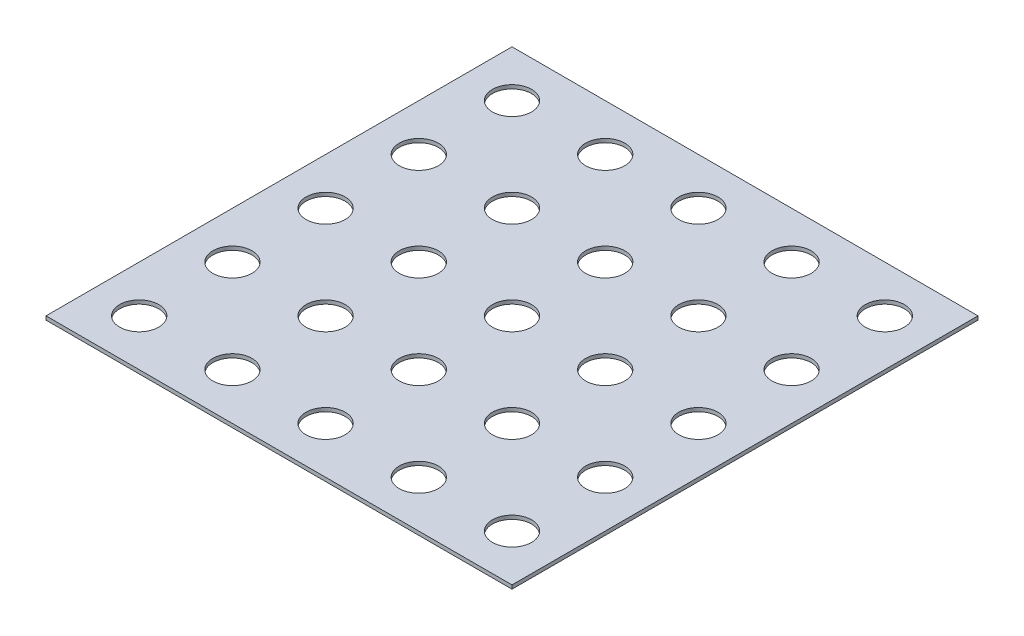
from build123d import *

# Parameters (mm, degrees)
SKETCH1_W           = 250
SKETCH1_H           = 250
BOSS_EXTRUDE1_DEPTH = 2
SKETCH2_R           = 10.5
CUT_EXTRUDE1_DEPTH  = 177.788008643


with BuildPart() as part:
    # Sketch1 → Boss-Extrude1 (new body)
    with BuildSketch(Plane(origin=(0, 0, 0), x_dir=(1, 0, 0), z_dir=(0, 1, 0))):
        Rectangle(SKETCH1_W, SKETCH1_H)
    extrude(amount=BOSS_EXTRUDE1_DEPTH)

    # Sketch2 → Cut-Extrude1 (cut, through all)
    with BuildSketch(Plane(origin=(0, 2, 0), x_dir=(1, 0, 0), z_dir=(0, 1, 0))):
        with Locations(Location((-100, 100, 0), (0, 0, 270))):
            Circle(SKETCH2_R)
        with Locations(Location((-50, 100, 0), (0, 0, 270))):
            Circle(SKETCH2_R)
        with Locations(Location((0, 100, 0), (0, 0, 270))):
            Circle(SKETCH2_R)
        with Locations(Location((50, 100, 0), (0, 0, 270))):
            Circle(SKETCH2_R)
        with Locations(Location((100, 100, 0), (0, 0, 270))):
            Circle(SKETCH2_R)
        with Locations(Location((-50, 50, 0), (0, 0, 270))):
            Circle(SKETCH2_R)
        with Locations(Location((0, 50, 0), (0, 0, 270))):
            Circle(SKETCH2_R)
        with Locations(Location((50, 50, 0), (0, 0, 270))):
            Circle(SKETCH2_R)
        with Locations(Location((100, 50, 0), (0, 0, 270))):
            Circle(SKETCH2_R)
        with Locations(Location((-50, 0, 0), (0, 0, 270))):
            Circle(SKETCH2_R)
        with Locations(Location((0, 0, 0), (0, 0, 270))):
            Circle(SKETCH2_R)
        with Locations(Location((50, 0, 0), (0, 0, 270))):
            Circle(SKETCH2_R)
        with Locations(Location((100, 0, 0), (0, 0, 270))):
            Circle(SKETCH2_R)
        with Locations(Location((-50, -50, 0), (0, 0, 270))):
            Circle(SKETCH2_R)
        with Locations(Location((0, -50, 0), (0, 0, 270))):
            Circle(SKETCH2_R)
        with Locations(Location((50, -50, 0), (0, 0, 270))):
            Circle(SKETCH2_R)
        with Locations(Location((100, -50, 0), (0, 0, 270))):
            Circle(SKETCH2_R)
        with Locations(Location((-50, -100, 0), (0, 0, 270))):
            Circle(SKETCH2_R)
        with Locations(Location((0, -100, 0), (0, 0, 270))):
            Circle(SKETCH2_R)
        with Locations(Location((50, -100, 0), (0, 0, 270))):
            Circle(SKETCH2_R)
        with Locations(Location((100, -100, 0), (0, 0, 270))):
            Circle(SKETCH2_R)
        with Locations(Location((-100, 50, 0), (0, 0, 270))):
            Circle(SKETCH2_R)
        with Locations(Location((-100, 0, 0), (0, 0, 270))):
            Circle(SKETCH2_R)
        with Locations(Location((-100, -50, 0), (0, 0, 270))):
            Circle(SKETCH2_R)
        with Locations(Location((-100, -100, 0), (0, 0, 270))):
            Circle(SKETCH2_R)
    extrude(amount=-CUT_EXTRUDE1_DEPTH, mode=Mode.SUBTRACT)


solid = part.part
